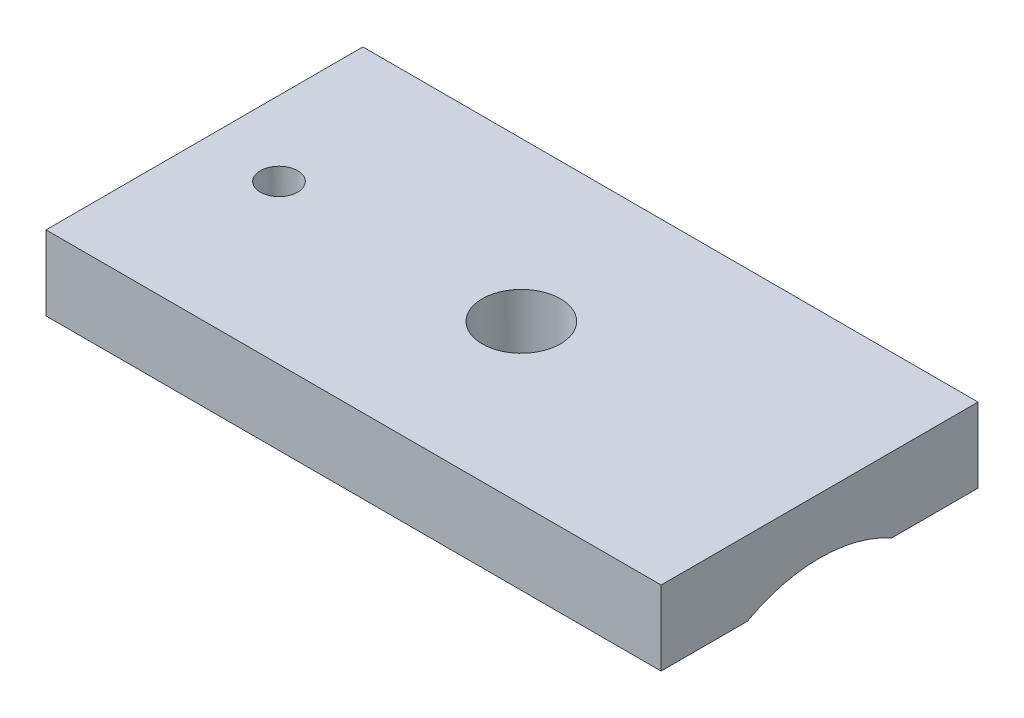
from build123d import *

# Parameters (mm, degrees)
SKETCH2_W             = 33
SKETCH2_H             = 17
BOSS_EXTRUDE1_DEPTH   = 2
M5_TAPPED_HOLE1_D     = 4.2
F_2_0MM_DOWEL_HOLE1_D = 2
SKETCH6_R             = 8
CUT_EXTRUDE1_DEPTH    = 35.135758377


with BuildPart() as part:
    # Sketch2 → Boss-Extrude1 (new, symmetric)
    with BuildSketch(Plane(origin=(0, 0, 0), x_dir=(1, 0, 0), z_dir=(0, 1, 0))):
        Rectangle(SKETCH2_W, SKETCH2_H)
    extrude(amount=BOSS_EXTRUDE1_DEPTH, both=True)

    # M5 Tapped Hole1 (through all)
    with Locations(Plane(origin=(0.5, 2, 0), x_dir=(0, 0, 1), z_dir=(0, 1, 0))):
        with Locations((0, 0)):
            Hole(M5_TAPPED_HOLE1_D / 2)

    # Ø2.0mm Dowel Hole1 (through all)
    with Locations(Plane(origin=(-12.5, 2, 0), x_dir=(0, 0, 1), z_dir=(0, 1, 0))):
        with Locations((0, 0)):
            Hole(F_2_0MM_DOWEL_HOLE1_D / 2)

    # Sketch6 → Cut-Extrude1 (cut, through all)
    with BuildSketch(Plane(origin=(16.5, 0, 0), x_dir=(0, 0, -1), z_dir=(1, 0, 0))):
        with Locations((0, -9)):
            Circle(SKETCH6_R)
    extrude(amount=-CUT_EXTRUDE1_DEPTH, mode=Mode.SUBTRACT)


solid = part.part
